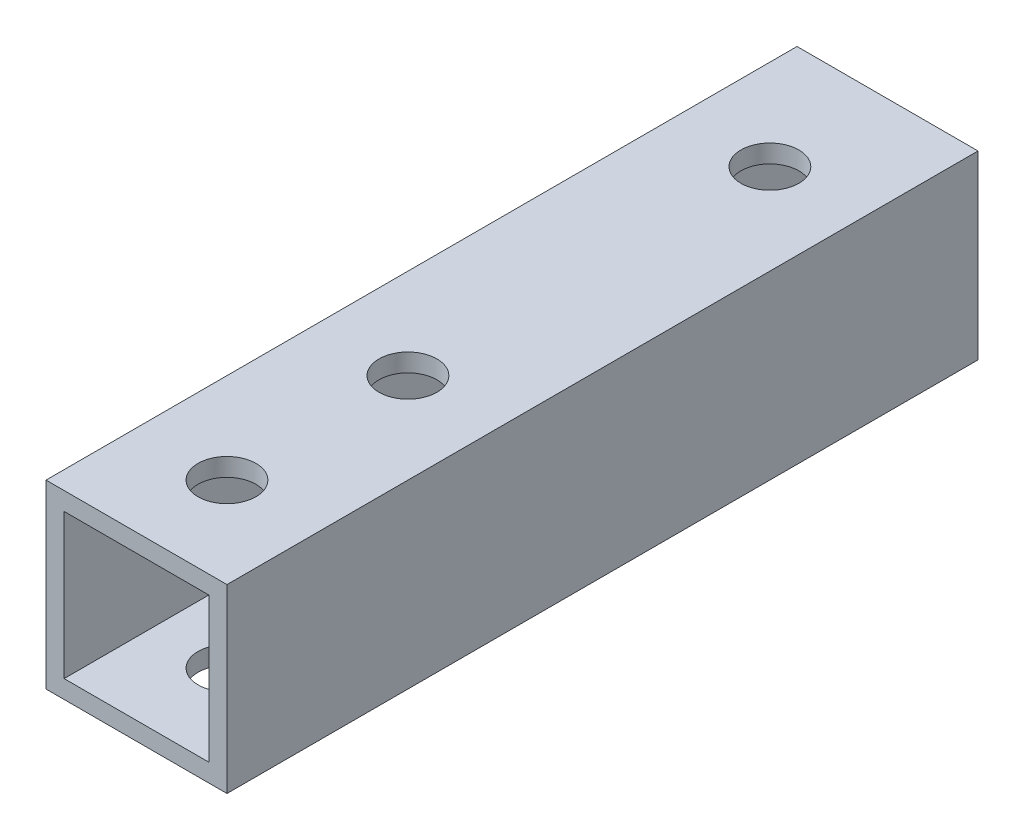
from build123d import *

# Parameters (mm, degrees)
SKETCH_1_W          = 10
SKETCH_1_H          = 10
SKETCH_1_W_2        = 8
SKETCH_1_H_2        = 8
EXTRUDE_1_DEPTH     = 41.5
SKETCH_2_R          = 1.6
CUT_EXTRUDE_1_DEPTH = 10


with BuildPart() as part:
    # ｽｹｯﾁ1 → 押し出し-薄板1 (new body)
    with BuildSketch(Plane.XY):
        Rectangle(SKETCH_1_W, SKETCH_1_H)
        Rectangle(SKETCH_1_W_2, SKETCH_1_H_2, mode=Mode.SUBTRACT)
    extrude(amount=EXTRUDE_1_DEPTH)

    # ｽｹｯﾁ2 → ｶｯﾄ - 押し出し1 (cut)
    with BuildSketch(Plane(origin=(0, 5, 0), x_dir=(1, 0, 0), z_dir=(0, 1, 0))):
        with BuildLine():
            ThreePointArc((1.6, -6.5), (1.13137085, -5.36862915), (0, -4.9))
            Line((0, -4.9), (0, -8.1))
            ThreePointArc((0, -8.1), (1.13137085, -7.63137085), (1.6, -6.5))
        make_face()
        with BuildLine():
            Line((0, -8.1), (0, -4.9))
            ThreePointArc((0, -4.9), (-1.6, -6.5), (0, -8.1))
        make_face()
        with BuildLine():
            ThreePointArc((1.6, -26.5), (1.13137085, -25.36862915), (0, -24.9))
            Line((0, -24.9), (0, -28.1))
            ThreePointArc((0, -28.1), (1.13137085, -27.63137085), (1.6, -26.5))
        make_face()
        with BuildLine():
            Line((0, -28.1), (0, -24.9))
            ThreePointArc((0, -24.9), (-1.6, -26.5), (0, -28.1))
        make_face()
        with Locations(Location((0, -36.5, 0), (0, 0, 270))):
            Circle(SKETCH_2_R)
    extrude(amount=-CUT_EXTRUDE_1_DEPTH, mode=Mode.SUBTRACT)


solid = part.part
